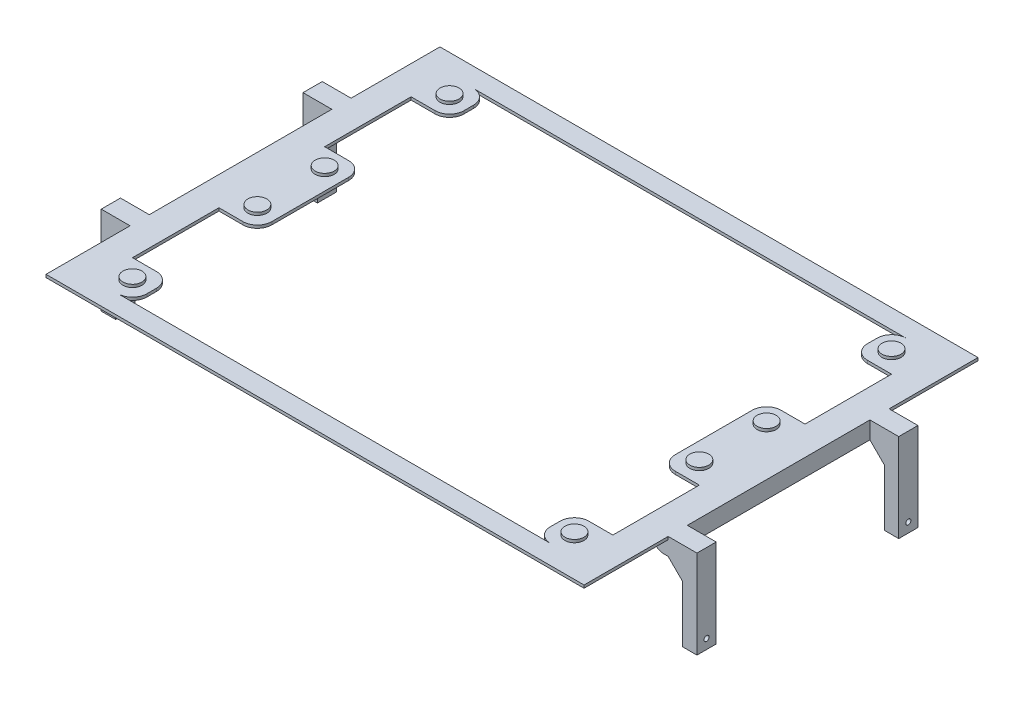
from build123d import *

# Parameters (mm, degrees)
SKETCH1_W            = 560
SKETCH1_H            = 410
BOSS_EXTRUDE1_DEPTH  = 3
SKETCH2_R            = 9.9
BOSS_EXTRUDE2_DEPTH  = 3
SKETCH3_W            = 30
SKETCH3_H            = 20
BOSS_EXTRUDE3_DEPTH  = 92
LPATTERN1_COUNT      = 2
LPATTERN1_PITCH      = 210
BOSS_EXTRUDE4_REACH  = 654.324
SKETCH4_W            = 15
SKETCH4_H            = 15
FILLET1_R            = 10
FILLET1_OF_MIRROR1_R = 10
SKETCH5_R            = 2.65
CUT_EXTRUDE1_DEPTH   = 92
CUT_EXTRUDE2_DEPTH   = 653.32449747


with BuildPart() as part:
    # Sketch1 → Boss-Extrude1 (new body)
    with BuildSketch(Plane(origin=(0, 0, 0), x_dir=(1, 0, 0), z_dir=(0, 1, 0))):
        with Locations((250, 185)):
            Rectangle(SKETCH1_W, SKETCH1_H)
        with BuildLine():
            Line((500, 130), (500, 40))
            Line((500, 40), (475, 40))
            ThreePointArc((475, 40), (464.393398282, 35.606601718), (460, 25))
            Line((460, 25), (460, 15))
            ThreePointArc((460, 15), (464.393398282, 4.393398282), (475, 0))
            Line((475, 0), (25, 0))
            ThreePointArc((25, 0), (35.606601718, 4.393398282), (40, 15))
            Line((40, 15), (40, 25))
            ThreePointArc((40, 25), (35.606601718, 35.606601718), (25, 40))
            Line((25, 40), (0, 40))
            Line((0, 40), (0, 130))
            Line((0, 130), (25, 130))
            ThreePointArc((25, 130), (35.606601718, 134.393398282), (40, 145))
            Line((40, 145), (40, 225))
            ThreePointArc((40, 225), (35.606601718, 235.606601718), (25, 240))
            Line((25, 240), (0, 240))
            Line((0, 240), (0, 330))
            Line((0, 330), (25, 330))
            ThreePointArc((25, 330), (35.606601718, 334.393398282), (40, 345))
            Line((40, 345), (40, 355))
            ThreePointArc((40, 355), (35.606601718, 365.606601718), (25, 370))
            Line((25, 370), (475, 370))
            ThreePointArc((475, 370), (464.393398282, 365.606601718), (460, 355))
            Line((460, 355), (460, 345))
            ThreePointArc((460, 345), (464.393398282, 334.393398282), (475, 330))
            Line((475, 330), (500, 330))
            Line((500, 330), (500, 240))
            Line((500, 240), (475, 240))
            ThreePointArc((475, 240), (464.393398282, 235.606601718), (460, 225))
            Line((460, 225), (460, 145))
            ThreePointArc((460, 145), (464.393398282, 134.393398282), (475, 130))
            Line((475, 130), (500, 130))
        make_face(mode=Mode.SUBTRACT)
    extrude(amount=BOSS_EXTRUDE1_DEPTH)

    # Sketch2 → Boss-Extrude2 (add)
    with BuildSketch(Plane(origin=(0, 3, 0), x_dir=(1, 0, 0), z_dir=(0, 1, 0))):
        with Locations(Location((20, 150, 0), (0, 0, 270))):
            Circle(SKETCH2_R)
        with Locations(Location((20, 220, 0), (0, 0, 270))):
            Circle(SKETCH2_R)
        with Locations(Location((20, 350, 0), (0, 0, 270))):
            Circle(SKETCH2_R)
        with Locations(Location((20, 20, 0), (0, 0, 270))):
            Circle(SKETCH2_R)
        with Locations(Location((480, 150, 0), (0, 0, 270))):
            Circle(SKETCH2_R)
        with Locations(Location((480, 220, 0), (0, 0, 270))):
            Circle(SKETCH2_R)
        with Locations(Location((480, 350, 0), (0, 0, 270))):
            Circle(SKETCH2_R)
        with Locations(Location((480, 20, 0), (0, 0, 270))):
            Circle(SKETCH2_R)
    extrude(amount=BOSS_EXTRUDE2_DEPTH)

    # Sketch3 → Boss-Extrude3 (add)
    with BuildSketch(Plane(origin=(0, 3, 0), x_dir=(1, 0, 0), z_dir=(0, 1, 0))):
        with Locations((545, 287.5)):
            Rectangle(SKETCH3_W, SKETCH3_H)
        with Locations((-45, 287.5)):
            Rectangle(SKETCH3_W, SKETCH3_H)
    boss_extrude3 = extrude(amount=-BOSS_EXTRUDE3_DEPTH)

    # LPattern1: Boss-Extrude3 ×2
    with Locations(*[(0, 0, i * LPATTERN1_PITCH) for i in range(1, LPATTERN1_COUNT)]):
        add(boss_extrude3)

    # Boss-Extrude4: up to this face of the body (flat: up to its plane)
    boss_extrude4_end = Plane(part.part.faces().sort_by_distance((-45, -43, -297.5))[0])
    # Sketch4 → Boss-Extrude4 (add, up to the picked face)
    with BuildSketch(Plane.XY.offset(-67.5), mode=Mode.PRIVATE) as boss_extrude4_sk1:
        with Locations((522.5, -7.5)):
            Rectangle(SKETCH4_W, SKETCH4_H)
    boss_extrude4_tool1 = split(extrude(boss_extrude4_sk1.sketch, amount=-BOSS_EXTRUDE4_REACH, mode=Mode.PRIVATE), bisect_by=boss_extrude4_end, keep=Keep.BOTH, mode=Mode.PRIVATE)
    boss_extrude4 = boss_extrude4_tool1.solids().sort_by(Axis((522.5, -7.5, -67.5), (0, 0, -1)))[0]
    add(boss_extrude4)

    # Fillet1
    fillet1_edges = [part.edges().sort_by_distance(p)[0] for p in [
        (515, -15, -182.5),
    ]]
    fillet(fillet1_edges, radius=FILLET1_R)

    # Mirror1: Boss-Extrude4 across plane
    add(boss_extrude4.mirror(Plane(origin=(250, 0, 0), x_dir=(0, 0, 1), z_dir=(1, 0, 0))))

    # Fillet1 of Mirror1
    fillet1_of_mirror1_edges = [part.edges().sort_by_distance(p)[0] for p in [
        (-15, -15, -182.5),
    ]]
    fillet(fillet1_of_mirror1_edges, radius=FILLET1_OF_MIRROR1_R)

    # Sketch5 → Cut-Extrude1 (cut)
    with BuildSketch(Plane(origin=(-30, 0, 0), x_dir=(0, 0, -1), z_dir=(1, 0, 0))):
        with Locations((77.5, -79)):
            Circle(SKETCH5_R)
        with Locations((287.5, -79)):
            Circle(SKETCH5_R)
    cut_extrude1 = extrude(amount=-CUT_EXTRUDE1_DEPTH, mode=Mode.SUBTRACT)

    # Mirror2: Cut-Extrude1 across plane
    add(cut_extrude1.mirror(Plane(origin=(250, 0, 0), x_dir=(0, 0, 1), z_dir=(1, 0, 0))), mode=Mode.SUBTRACT)

    # Sketch6 → Cut-Extrude2 (cut, through all)
    with BuildSketch(Plane.XY.offset(-67.5)):
        Polygon((-45, -89), (-45, -30), (-30, -15), (-30, -89), align=None)
    cut_extrude2 = extrude(amount=-CUT_EXTRUDE2_DEPTH, mode=Mode.SUBTRACT)

    # Mirror3: Cut-Extrude2 across plane
    add(cut_extrude2.mirror(Plane(origin=(250, 0, 0), x_dir=(0, 0, 1), z_dir=(1, 0, 0))), mode=Mode.SUBTRACT)


solid = part.part
